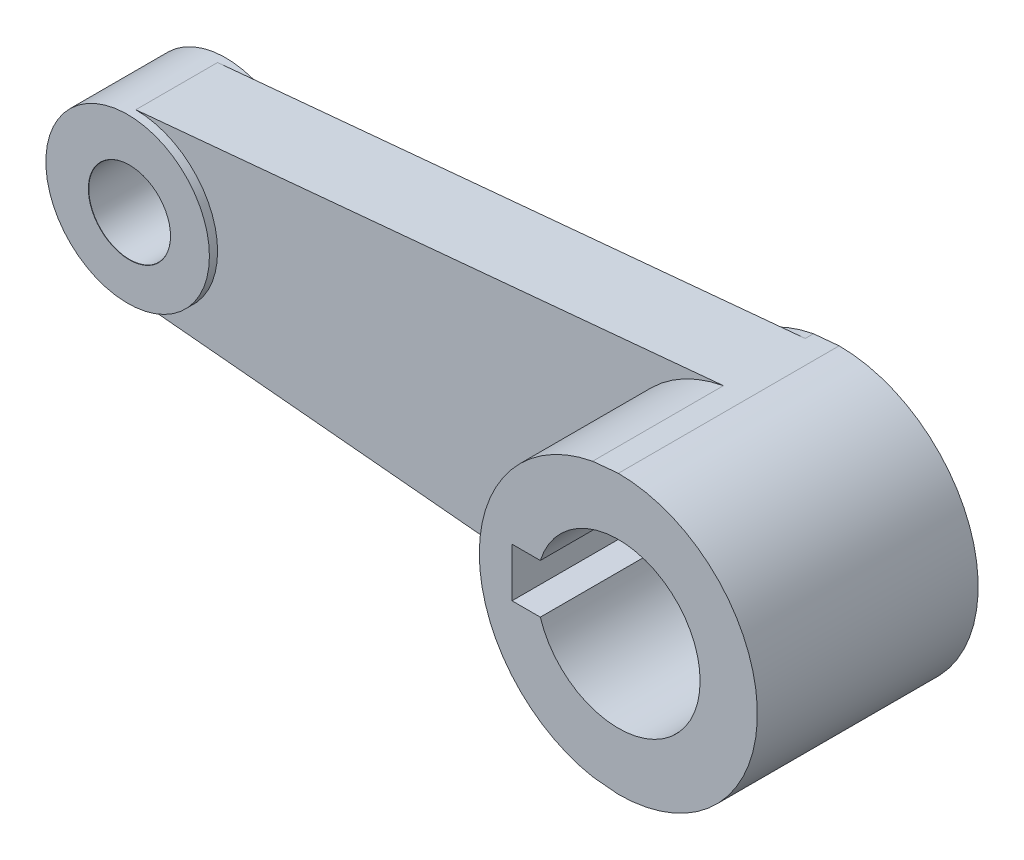
from build123d import *

# Parameters (mm, degrees)
ESTRUSIONE_ESTRUSIONE1_DEPTH = 5
SCHIZZO1_4_R                 = 10
ESTRUSIONE_ESTRUSIONE2_DEPTH = 6
ESTRUSIONE_ESTRUSIONE3_START = 21
ESTRUSIONE_ESTRUSIONE3_DEPTH = 27
FORO_10_0_10_1_D             = 10
FORO_10_0_10_1_CSINK_D       = 10.05
FORO_10_0_10_1_CSINK_ANGLE   = 90


with BuildPart() as part:
    # Schizzo1 → Estrusione-Estrusione1 (new, symmetric)
    with BuildSketch(Plane.XY):
        with BuildLine():
            ThreePointArc((-3.145928798, -16.706379979), (-17, 0), (-3.145928798, 16.706379979))
            Line((-3.145928798, 16.706379979), (-75, 10))
            ThreePointArc((-75, 10), (-67.928932188, 7.071067812), (-65, 0))
            ThreePointArc((-65, 0), (-67.928932188, -7.071067812), (-75, -10))
            Line((-75, -10), (-3.145928798, -16.706379979))
        make_face()
    extrude(amount=ESTRUSIONE_ESTRUSIONE1_DEPTH, both=True)

    # Schizzo1<4> → Estrusione-Estrusione2 (add, symmetric)
    with BuildSketch(Plane.XY):
        with Locations((-75, 0)):
            Circle(SCHIZZO1_4_R)
    extrude(amount=ESTRUSIONE_ESTRUSIONE2_DEPTH, both=True)

    # Schizzo1<5> → Estrusione-Estrusione3 (add)
    with BuildSketch(Plane.XY.offset(ESTRUSIONE_ESTRUSIONE3_START)):
        with BuildLine():
            ThreePointArc((17, 0), (12.02081528, 12.02081528), (0, 17))
            Line((0, 17), (-3.145928798, 16.706379979))
            ThreePointArc((-3.145928798, 16.706379979), (-17, 0), (-3.145928798, -16.706379979))
            Line((-3.145928798, -16.706379979), (0, -17))
            ThreePointArc((0, -17), (12.02081528, -12.02081528), (17, 0))
        make_face()
        with BuildLine():
            Line((-13, 3), (-9.539392014, 3))
            ThreePointArc((-9.539392014, 3), (10, 0), (-9.539392014, -3))
            Line((-9.539392014, -3), (-13, -3))
            Line((-13, -3), (-13, 3))
        make_face(mode=Mode.SUBTRACT)
    extrude(amount=-ESTRUSIONE_ESTRUSIONE3_DEPTH)

    # Foro Ø10.0 (10)-1 (through all)
    with Locations(Plane(origin=(-74.779419459, -0.265735381, 6), x_dir=(1, 0, 0), z_dir=(0, 0, 1))):
        with Locations((0, 0)):
            CounterSinkHole(FORO_10_0_10_1_D / 2, FORO_10_0_10_1_CSINK_D / 2, counter_sink_angle=FORO_10_0_10_1_CSINK_ANGLE)


solid = part.part
